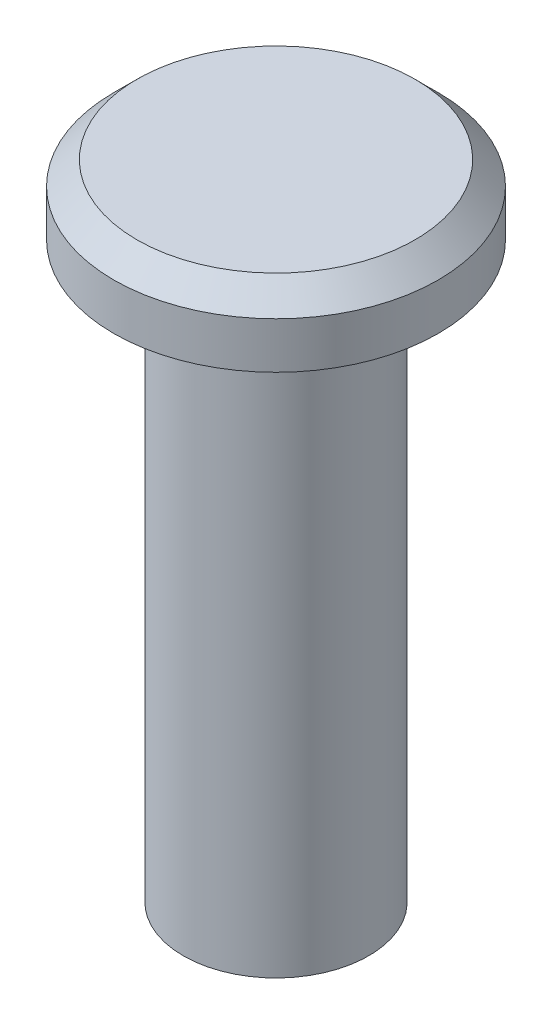
from build123d import *

# Parameters (mm, degrees)
SKETCH2_R           = 7
BOSS_EXTRUDE1_DEPTH = 3
SKETCH3_R           = 4
BOSS_EXTRUDE2_DEPTH = 24.75
CHAMFER1_SIZE       = 1


with BuildPart() as part:
    # Sketch2 → Boss-Extrude1 (new body)
    with BuildSketch(Plane(origin=(0, 0, 0), x_dir=(1, 0, 0), z_dir=(0, 1, 0))):
        with Locations(Location((0, 0, 0), (0, 0, 270))):
            Circle(SKETCH2_R)
    extrude(amount=BOSS_EXTRUDE1_DEPTH)

    # Sketch3 → Boss-Extrude2 (add)
    with BuildSketch(Plane.XZ):
        with Locations(Location((0, 0, 0), (0, 0, 270))):
            Circle(SKETCH3_R)
    extrude(amount=BOSS_EXTRUDE2_DEPTH)

    # Chamfer1
    chamfer1_edges = [part.edges().sort_by_distance(p)[0] for p in [
        (0, 3, -7),
    ]]
    chamfer(chamfer1_edges, length=CHAMFER1_SIZE)


solid = part.part
